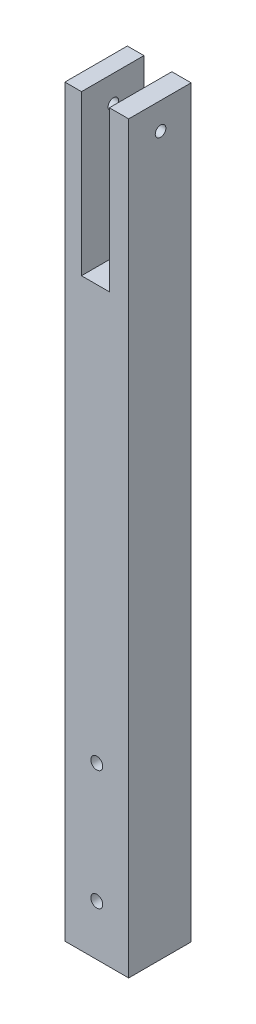
from build123d import *

# Parameters (mm, degrees)
ESQUISSE1_W        = 280
ESQUISSE1_H        = 24
MAIN_DEPTH         = 24
ESQUISSE3_W        = 10.5
ESQUISSE3_H        = 24
FOURCHE_DEPTH      = 60
ESQUISSE5_R        = 2
TROU_FOURCHE_DEPTH = 27
ESQUISSE6_R        = 2.25
TROU_EQUERRE_DEPTH = 27
CHANFREIN1_SIZE    = 0.5
CHANFREIN2_SIZE    = 0.5
CHANFREIN3_SIZE    = 0.5
CHANFREIN4_SIZE    = 0.5
CHANFREIN5_SIZE    = 0.5
CHANFREIN6_SIZE    = 0.5
CHANFREIN7_SIZE    = 0.5
CHANFREIN8_SIZE    = 0.3
CHANFREIN9_SIZE    = 0.3
CHANFREIN11_SIZE   = 0.5


with BuildPart() as part:
    # Esquisse1 → main (new body)
    with BuildSketch(Plane(origin=(0, 0, 0), x_dir=(0, 1, 0), z_dir=(0, 0, 1))):
        with Locations((81.467203596, 5.71524514)):
            Rectangle(ESQUISSE1_W, ESQUISSE1_H)
    extrude(amount=MAIN_DEPTH)

    # Esquisse3 → fourche (cut)
    with BuildSketch(Plane(origin=(0, 221.467203596, 0), x_dir=(-1, 0, 0), z_dir=(0, 1, 0))):
        with Locations((6.21524514, 12)):
            Rectangle(ESQUISSE3_W, ESQUISSE3_H)
    extrude(amount=-FOURCHE_DEPTH, mode=Mode.SUBTRACT)

    # Esquisse5 → trou_fourche (cut)
    with BuildSketch(Plane(origin=(-17.71524514, 0, 0), x_dir=(0, -1, 0), z_dir=(-1, 0, 0))):
        with Locations(Location((-211.467203596, 12, 0), (0, 0, 90))):
            Circle(ESQUISSE5_R)
    extrude(amount=-TROU_FOURCHE_DEPTH, mode=Mode.SUBTRACT)

    # Esquisse6 → trou_equerre (cut)
    with BuildSketch(Plane(origin=(0, 0, 0), x_dir=(1, 0, 0), z_dir=(0, 0, -1))):
        with Locations(Location((-5.71524514, 39.482796404, 0), (0, 0, 180))):
            Circle(ESQUISSE6_R)
        with Locations(Location((-5.71524514, -5.517203596, 0), (0, 0, 180))):
            Circle(ESQUISSE6_R)
    extrude(amount=-TROU_EQUERRE_DEPTH, mode=Mode.SUBTRACT)

    # Chanfrein1
    chanfrein1_edges = [part.edges().sort_by_distance(p)[0] for p in [
        (6.28475486, 81.467203596, 0),
    ]]
    chamfer(chanfrein1_edges, length=CHANFREIN1_SIZE)

    # Chanfrein2
    chanfrein2_edges = [part.edges().sort_by_distance(p)[0] for p in [
        (-11.46524514, 191.467203596, 0),
    ]]
    chamfer(chanfrein2_edges, length=CHANFREIN2_SIZE)

    # Chanfrein3
    chanfrein3_edges = [part.edges().sort_by_distance(p)[0] for p in [
        (-0.96524514, 191.467203596, 0),
    ]]
    chamfer(chanfrein3_edges, length=CHANFREIN3_SIZE)

    # Chanfrein4
    chanfrein4_edges = [part.edges().sort_by_distance(p)[0] for p in [
        (-14.84024514, 221.467203596, 0),
    ]]
    chamfer(chanfrein4_edges, length=CHANFREIN4_SIZE)

    # Chanfrein5
    chanfrein5_edges = [part.edges().sort_by_distance(p)[0] for p in [
        (2.65975486, 221.467203596, 0),
    ]]
    chamfer(chanfrein5_edges, length=CHANFREIN5_SIZE)

    # Chanfrein6
    chanfrein6_edges = [part.edges().sort_by_distance(p)[0] for p in [
        (-6.21524514, 161.467203596, 0),
    ]]
    chamfer(chanfrein6_edges, length=CHANFREIN6_SIZE)

    # Chanfrein7
    chanfrein7_edges = [part.edges().sort_by_distance(p)[0] for p in [
        (-17.71524514, 81.217203596, 0),
    ]]
    chamfer(chanfrein7_edges, length=CHANFREIN7_SIZE)

    # Chanfrein8
    chanfrein8_edges = [part.edges().sort_by_distance(p)[0] for p in [
        (-3.46524514, 5.517203596, 0),
    ]]
    chamfer(chanfrein8_edges, length=CHANFREIN8_SIZE)

    # Chanfrein9
    chanfrein9_edges = [part.edges().sort_by_distance(p)[0] for p in [
        (-3.46524514, -39.482796404, 0),
    ]]
    chamfer(chanfrein9_edges, length=CHANFREIN9_SIZE)

    # Chanfrein11
    chanfrein11_edges = [part.edges().sort_by_distance(p)[0] for p in [
        (-5.71524514, -58.532796404, 0),
    ]]
    chamfer(chanfrein11_edges, length=CHANFREIN11_SIZE)


solid = part.part
